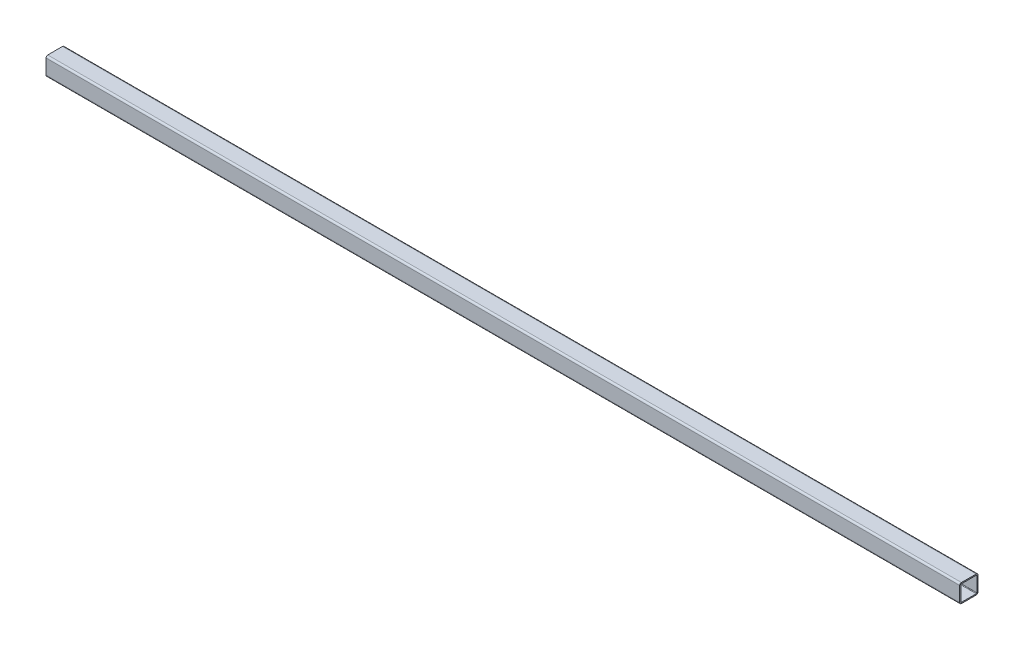
from build123d import *

# Parameters (mm, degrees)
BXBXS_8639_82_40_X_40_X_2_5_1_DEPTH = 2000


with BuildPart() as part:
    # Sketch1 → Труба bxbxs гост8639-82 40 X 40 X 2.5(1) (new body)
    with BuildSketch(Plane.YZ.offset(-1000)):
        with BuildLine():
            Line((-16.25, -20), (16.25, -20))
            ThreePointArc((16.25, -20), (18.901650429, -18.901650429), (20, -16.25))
            Line((20, -16.25), (20, 16.25))
            ThreePointArc((20, 16.25), (18.901650429, 18.901650429), (16.25, 20))
            Line((16.25, 20), (-16.25, 20))
            ThreePointArc((-16.25, 20), (-18.901650429, 18.901650429), (-20, 16.25))
            Line((-20, 16.25), (-20, -16.25))
            ThreePointArc((-20, -16.25), (-18.901650429, -18.901650429), (-16.25, -20))
        make_face()
        with BuildLine():
            Line((-16.25, -17.5), (16.25, -17.5))
            ThreePointArc((16.25, -17.5), (17.133883476, -17.133883476), (17.5, -16.25))
            Line((17.5, -16.25), (17.5, 16.25))
            ThreePointArc((17.5, 16.25), (17.133883476, 17.133883476), (16.25, 17.5))
            Line((16.25, 17.5), (-16.25, 17.5))
            ThreePointArc((-16.25, 17.5), (-17.133883476, 17.133883476), (-17.5, 16.25))
            Line((-17.5, 16.25), (-17.5, -16.25))
            ThreePointArc((-17.5, -16.25), (-17.133883476, -17.133883476), (-16.25, -17.5))
        make_face(mode=Mode.SUBTRACT)
    extrude(amount=BXBXS_8639_82_40_X_40_X_2_5_1_DEPTH)


solid = part.part
